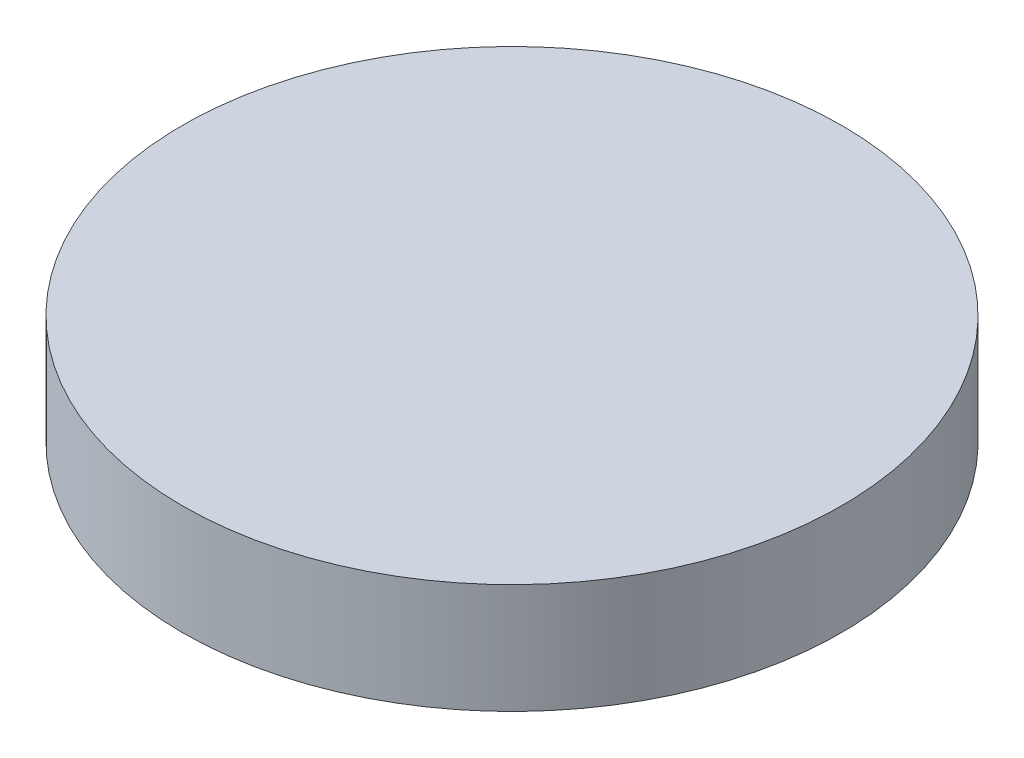
from build123d import *

# Parameters (mm, degrees)
SKETCH2_R           = 4.7625
BOSS_EXTRUDE1_DEPTH = 1.5875


with BuildPart() as part:
    # Sketch2 → Boss-Extrude1 (new body)
    with BuildSketch(Plane(origin=(0, 0, 0), x_dir=(1, 0, 0), z_dir=(0, 1, 0))):
        with Locations(Location((0, 0, 0), (0, 0, 270))):
            Circle(SKETCH2_R)
    extrude(amount=BOSS_EXTRUDE1_DEPTH)


solid = part.part
